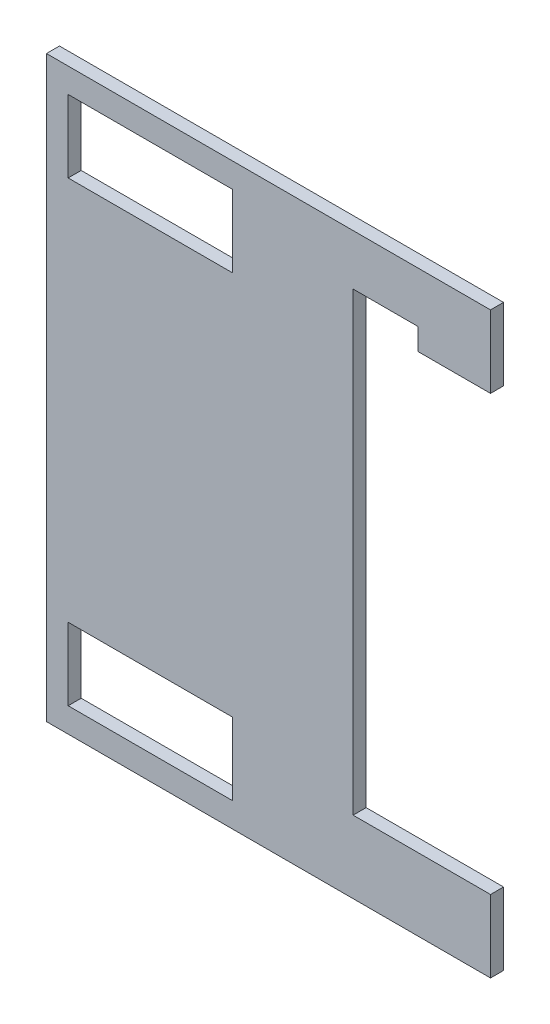
from build123d import *

# Parameters (mm, degrees)
SKETCH1_W           = 306.999208532
SKETCH1_H           = 400
SKETCH1_W_2         = 113.639208532
SKETCH1_H_2         = 50
BOSS_EXTRUDE1_DEPTH = 9
SKETCH2_W           = 95
SKETCH2_H           = 300
CUT_EXTRUDE1_DEPTH  = 460.151907085
SKETCH3_W           = 45
SKETCH3_H           = 15
CUT_EXTRUDE2_DEPTH  = 10


with BuildPart() as part:
    # Sketch1 → Boss-Extrude1 (new body)
    with BuildSketch(Plane.XY):
        with Locations((-170.312553906, 125.4)):
            Rectangle(SKETCH1_W, SKETCH1_H)
        with Locations((-251.992553906, 283.4)):
            Rectangle(SKETCH1_W_2, SKETCH1_H_2, mode=Mode.SUBTRACT)
        with Locations((-251.992553906, -32.6)):
            Rectangle(SKETCH1_W_2, SKETCH1_H_2, mode=Mode.SUBTRACT)
    extrude(amount=BOSS_EXTRUDE1_DEPTH)

    # Sketch2 → Cut-Extrude1 (cut, through all)
    with BuildSketch(Plane(origin=(0, 0, 0), x_dir=(-1, 0, 0), z_dir=(0, 0, -1))):
        with Locations((64.31294964, 125.4)):
            Rectangle(SKETCH2_W, SKETCH2_H)
    extrude(amount=-CUT_EXTRUDE1_DEPTH, mode=Mode.SUBTRACT)

    # Sketch3 → Cut-Extrude2 (cut)
    with BuildSketch(Plane(origin=(0, 0, 0), x_dir=(-1, 0, 0), z_dir=(0, 0, -1))):
        with Locations((89.31294964, 282.9)):
            Rectangle(SKETCH3_W, SKETCH3_H)
    extrude(amount=-CUT_EXTRUDE2_DEPTH, mode=Mode.SUBTRACT)


solid = part.part
